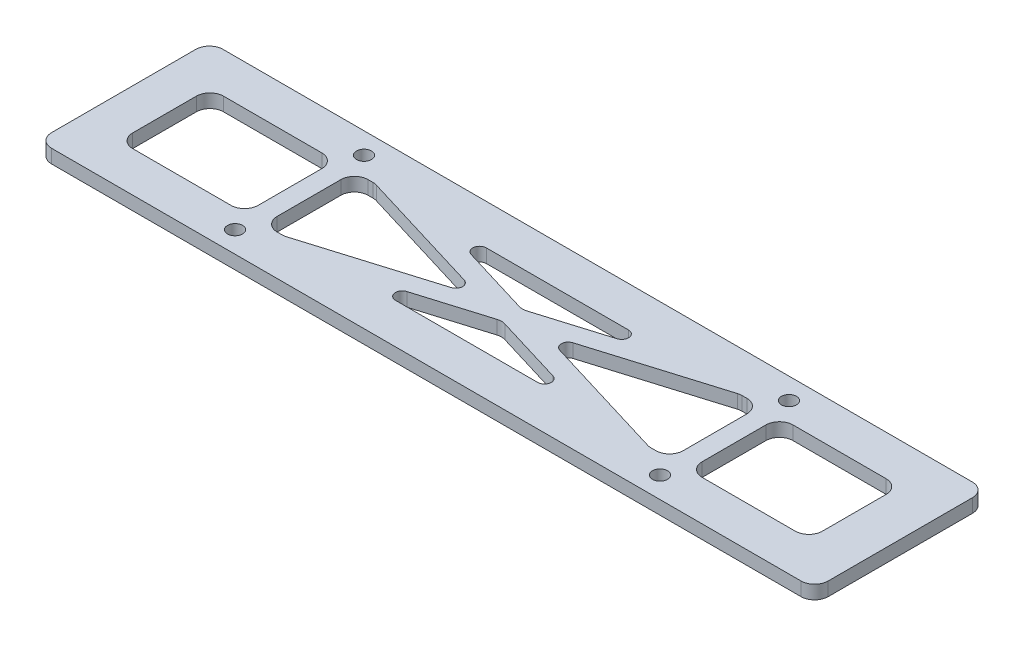
from build123d import *

# Parameters (mm, degrees)
SKETCH1_W           = 145.0086
SKETCH1_H           = 32.004
SKETCH1_R           = 1.399999994
SKETCH1_R_2         = 1.399999995
SKETCH1_W_2         = 22.457386235
SKETCH1_H_2         = 16.9672
SKETCH1_W_3         = 23.43040653
BOSS_EXTRUDE1_DEPTH = 2.54
FILLET1_R           = 2.54
FILLET2_R           = 1.27


with BuildPart() as part:
    # Sketch1 → Boss-Extrude1 (new body)
    with BuildSketch(Plane(origin=(0, 0, 0), x_dir=(1, 0, 0), z_dir=(0, 1, 0))):
        with Locations((6.69779506, 14.755388179)):
            Rectangle(SKETCH1_W, SKETCH1_H)
        with Locations(Location((-32.97809841, 26.794988179, 0), (0, 0, 270))):
            Circle(SKETCH1_R, mode=Mode.SUBTRACT)
        with Locations(Location((46.373688528, 26.794988179, 0), (0, 0, 90))):
            Circle(SKETCH1_R_2, mode=Mode.SUBTRACT)
        with Locations(Location((46.373688528, 2.715788179, 0), (0, 0, 270))):
            Circle(SKETCH1_R_2, mode=Mode.SUBTRACT)
        with Locations(Location((-32.97809841, 2.715788179, 0), (0, 0, 90))):
            Circle(SKETCH1_R, mode=Mode.SUBTRACT)
        Polygon((-31.20009841, 23.238988179), (-27.382615546, 23.238988179), (0.574659599, 14.755388179), (-27.382615546, 6.271788179), (-31.20009841, 6.271788179), align=None, mode=Mode.SUBTRACT)
        with Locations((59.380381646, 14.755388179)):
            Rectangle(SKETCH1_W_2, SKETCH1_H_2, mode=Mode.SUBTRACT)
        with Locations((-46.471301675, 14.755388179)):
            Rectangle(SKETCH1_W_3, SKETCH1_H_2, mode=Mode.SUBTRACT)
        Polygon((40.778205663, 23.238988179), (12.820930519, 14.755388179), (40.778205663, 6.271788179), (44.595688528, 6.271788179), (44.595688528, 23.238988179), align=None, mode=Mode.SUBTRACT)
        Polygon((-15.136344626, 23.238988179), (6.697795059, 16.613445937), (28.531934744, 23.238988179), align=None, mode=Mode.SUBTRACT)
        Polygon((6.697795059, 12.897330421), (-15.136344626, 6.271788179), (28.531934744, 6.271788179), align=None, mode=Mode.SUBTRACT)
    extrude(amount=BOSS_EXTRUDE1_DEPTH)

    # Fillet1
    fillet1_edges = [part.edges().sort_by_distance(p)[0] for p in [
        (70.609074763, 1.27, -6.271788179),
        (70.609074763, 1.27, -23.238988179),
        (48.151688528, 1.27, -23.238988179),
        (48.151688528, 1.27, -6.271788179),
        (-58.18650494, 1.27, -23.238988179),
        (-58.18650494, 1.27, -6.271788179),
        (-34.75609841, 1.27, -6.271788179),
        (-34.75609841, 1.27, -23.238988179),
        (6.697795059, 1.27, -16.613445937),
        (6.697795059, 1.27, -12.897330421),
        (79.20209506, 1.27, 1.246611821),
        (-65.80650494, 1.27, 1.246611821),
        (-65.80650494, 1.27, -30.757388179),
        (79.20209506, 1.27, -30.757388179),
        (44.595688528, 1.27, -23.238988179),
        (40.778205663, 1.27, -23.238988179),
        (40.778205663, 1.27, -6.271788179),
        (44.595688528, 1.27, -6.271788179),
        (-31.20009841, 1.27, -23.238988179),
        (-31.20009841, 1.27, -6.271788179),
        (-27.382615546, 1.27, -6.271788179),
        (-27.382615546, 1.27, -23.238988179),
    ]]
    fillet(fillet1_edges, radius=FILLET1_R)

    # Fillet2
    fillet2_edges = [part.edges().sort_by_distance(p)[0] for p in [
        (28.531934744, 1.27, -23.238988179),
        (-15.136344626, 1.27, -23.238988179),
        (-15.136344626, 1.27, -6.271788179),
        (28.531934744, 1.27, -6.271788179),
        (12.820930519, 1.27, -14.755388179),
        (0.574659599, 1.27, -14.755388179),
    ]]
    fillet(fillet2_edges, radius=FILLET2_R)


solid = part.part
